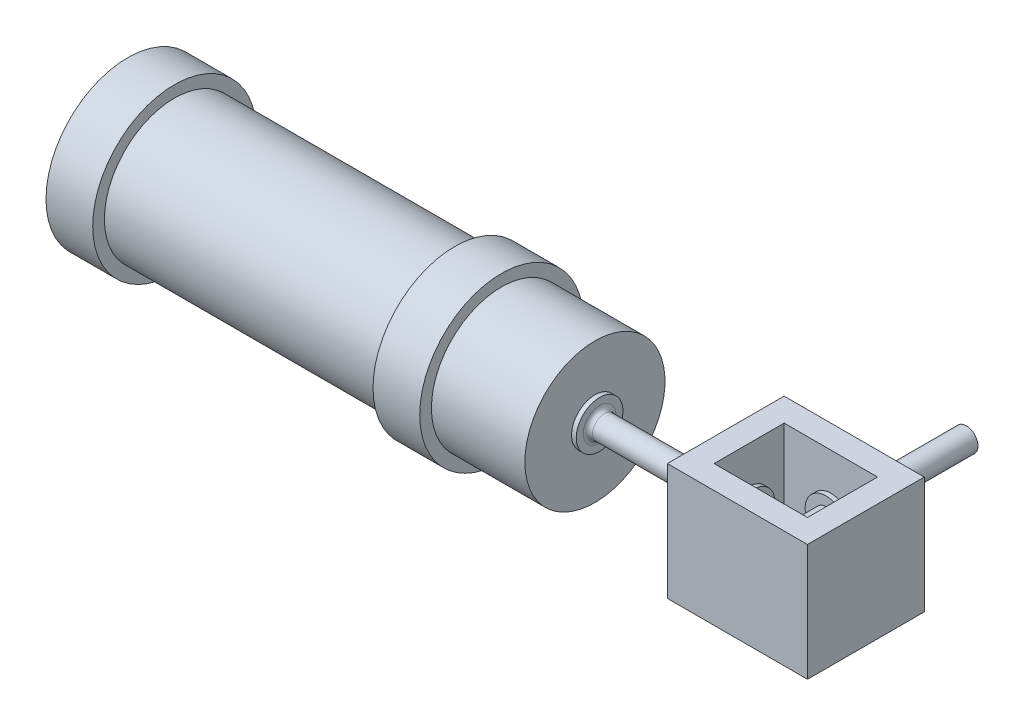
from build123d import *

# Parameters (mm, degrees)
SKETCH10_R                  = 2.5
BOSS_EXTRUDE1_DEPTH         = 37
BOSS_EXTRUDE2_START         = -10
SKETCH11_W                  = 25
SKETCH11_H                  = 25
BOSS_EXTRUDE2_DEPTH         = 30
SKETCH13_W                  = 20
SKETCH13_H                  = 15
CUT_EXTRUDE3_DEPTH          = 30
FILLET1_R                   = 1
M6_TAPPED_HOLE1_D           = 5
M6_TAPPED_HOLE1_DEPTH       = 30
M6_TAPPED_HOLE1_CSINK_D     = 6.05
M6_TAPPED_HOLE1_CSINK_ANGLE = 90
M6_TAPPED_HOLE1_TIP         = 1.502151548
M6_TAPPED_HOLE2_D           = 5
M6_TAPPED_HOLE2_DEPTH       = 30
M6_TAPPED_HOLE2_CSINK_D     = 6.05
M6_TAPPED_HOLE2_CSINK_ANGLE = 90
M6_TAPPED_HOLE2_TIP         = 1.502151548
SKETCH9_W                   = 18
SKETCH9_H                   = 4
CUT_EXTRUDE2_DEPTH          = 2
SKETCH14_R                  = 2.5
BOSS_EXTRUDE3_DEPTH         = 37.7
FILLET2_R                   = 1
SKETCH16_R                  = 4.5
BOSS_EXTRUDE4_DEPTH         = 1
SKETCH18_R                  = 4.5
BOSS_EXTRUDE6_DEPTH         = 1
BOSS_EXTRUDE7_DEPTH         = 5
BOSS_EXTRUDE7_DEPTH_BACK    = 30
SKETCH19_R                  = 2.5
FILLET3_R                   = 1


with BuildPart() as part:
    # Sketch2 → Revolve1 (revolve)
    with BuildSketch(Plane.XY):
        Polygon((0, 0), (0, 17.5), (10, 17.5), (10, 15), (70, 15), (70, 17.5), (80, 17.5), (80, 15), (100, 15), (100, 5), (101, 5), (101, 2.5), (101, 0), (70.994843836, 0), align=None)
    revolve(axis=Axis((0, 0, 0), (1, 0, 0)))

    # Sketch10 → Boss-Extrude1 (add)
    with BuildSketch(Plane(origin=(101, 0, 0), x_dir=(0, 0, -1), z_dir=(1, 0, 0))):
        Circle(SKETCH10_R)
    extrude(amount=BOSS_EXTRUDE1_DEPTH)

    # Sketch11 → Boss-Extrude2 (add)
    with BuildSketch(Plane(origin=(138, 0, 0), x_dir=(0, 0, -1), z_dir=(1, 0, 0)).offset(BOSS_EXTRUDE2_START)):
        Rectangle(SKETCH11_W, SKETCH11_H)
    extrude(amount=BOSS_EXTRUDE2_DEPTH)

    # Sketch13 → Cut-Extrude3 (cut)
    with BuildSketch(Plane(origin=(0, 12.5, 0), x_dir=(1, 0, 0), z_dir=(0, 1, 0))):
        with Locations((143, 0)):
            Rectangle(SKETCH13_W, SKETCH13_H)
    extrude(amount=-CUT_EXTRUDE3_DEPTH, mode=Mode.SUBTRACT)

    # Fillet1
    fillet1_edges = [part.edges().sort_by_distance(p)[0] for p in [
        (101, 0, 2.5),
        (128, 0, 2.5),
    ]]
    fillet(fillet1_edges, radius=FILLET1_R)

    # M6 Tapped Hole1
    with Locations(Plane(origin=(0, 0, 0), x_dir=(0, 0, -1), z_dir=(-1, 0, 0))):
        with Locations((0, 0)):
            CounterSinkHole(M6_TAPPED_HOLE1_D / 2, M6_TAPPED_HOLE1_CSINK_D / 2, depth=M6_TAPPED_HOLE1_DEPTH, counter_sink_angle=M6_TAPPED_HOLE1_CSINK_ANGLE)
            with Locations((0, 0, -(M6_TAPPED_HOLE1_DEPTH + M6_TAPPED_HOLE1_TIP / 2))):  # 118° drill point
                Cone(0, M6_TAPPED_HOLE1_D / 2, M6_TAPPED_HOLE1_TIP, mode=Mode.SUBTRACT)

    # M6 Tapped Hole2
    with Locations(Plane(origin=(0, -0.192029445, 8.997951139), x_dir=(0, 0, -1), z_dir=(-1, 0, 0))):
        with Locations((0, 0), (17.997918621, -0.167835984)):
            CounterSinkHole(M6_TAPPED_HOLE2_D / 2, M6_TAPPED_HOLE2_CSINK_D / 2, depth=M6_TAPPED_HOLE2_DEPTH, counter_sink_angle=M6_TAPPED_HOLE2_CSINK_ANGLE)
            with Locations((0, 0, -(M6_TAPPED_HOLE2_DEPTH + M6_TAPPED_HOLE2_TIP / 2))):  # 118° drill point
                Cone(0, M6_TAPPED_HOLE2_D / 2, M6_TAPPED_HOLE2_TIP, mode=Mode.SUBTRACT)

    # Sketch9 → Cut-Extrude2 (cut)
    with BuildSketch(Plane.ZY):
        Rectangle(SKETCH9_W, SKETCH9_H)
    extrude(amount=-CUT_EXTRUDE2_DEPTH, mode=Mode.SUBTRACT)

    # Sketch14 → Boss-Extrude3 (add)
    with BuildSketch(Plane(origin=(101, 0, 0), x_dir=(0, 0, -1), z_dir=(1, 0, 0))):
        Circle(SKETCH14_R)
    extrude(amount=BOSS_EXTRUDE3_DEPTH)

    # Fillet2
    fillet2_edges = [part.edges().sort_by_distance(p)[0] for p in [
        (138.7, 0, 2.5),
    ]]
    fillet(fillet2_edges, radius=FILLET2_R)

    # Sketch16 → Boss-Extrude4 (add)
    with BuildSketch(Plane(origin=(133, 0, 0), x_dir=(0, 0, -1), z_dir=(1, 0, 0))):
        Circle(SKETCH16_R)
    extrude(amount=BOSS_EXTRUDE4_DEPTH)

    # Sketch18 → Boss-Extrude6 (add)
    with BuildSketch(Plane.XY.offset(-7.5)):
        with Locations((143, 0)):
            Circle(SKETCH18_R)
    extrude(amount=BOSS_EXTRUDE6_DEPTH)

    # Sketch19 → Boss-Extrude7 (add, two sides: drawn at the far end of the back side and taken through both)
    with BuildSketch(Plane.XY.offset(-6.5).offset(-BOSS_EXTRUDE7_DEPTH_BACK)):
        with Locations((143, 0)):
            Circle(SKETCH19_R)
    extrude(amount=BOSS_EXTRUDE7_DEPTH + BOSS_EXTRUDE7_DEPTH_BACK)

    # Fillet3
    fillet3_edges = [part.edges().sort_by_distance(p)[0] for p in [
        (140.5, 0, -1.5),
    ]]
    fillet(fillet3_edges, radius=FILLET3_R)


solid = part.part
